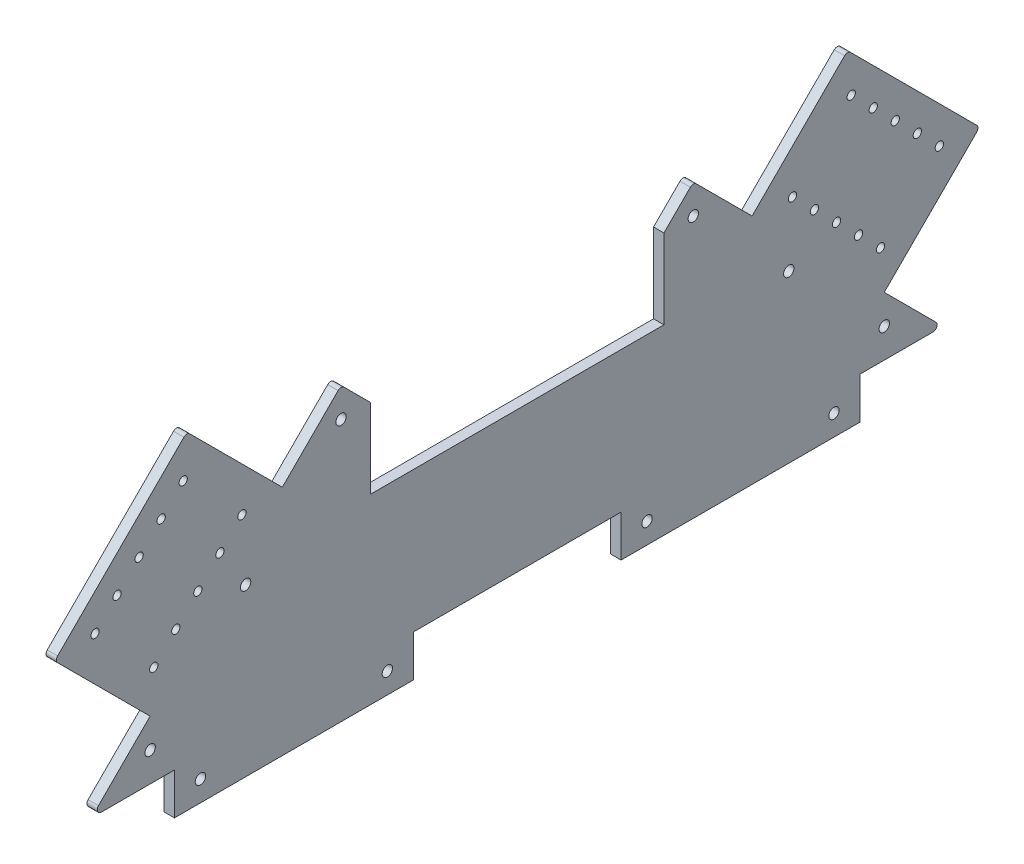
from build123d import *

# Parameters (mm, degrees)
SKETCH_1_R      = 2.5
SKETCH_1_R_2    = 2
EXTRUDE_1_DEPTH = 5
FILLET_1_R      = 2


with BuildPart() as part:
    # 草图1 → 凸台-拉伸1 (new body)
    with BuildSketch(Plane(origin=(0, 0, 0), x_dir=(0, 0, -1), z_dir=(1, 0, 0))):
        Polygon((165, 0), (205, 0), (176.715728753, 28.284271247), (222.67766953, 74.246212025), (159.038059223, 137.885822331), (113.076118446, 91.923881554), (84.791847198, 120.208152802), (70.649711575, 106.066017178), (70.649711575, 67.772939569), (-70.649711575, 67.772939569), (-70.649711575, 106.066017178), (-84.791847198, 120.208152802), (-113.076118446, 91.923881554), (-159.038059223, 137.885822331), (-222.67766953, 74.246212025), (-176.715728753, 28.284271247), (-205, 0), (-165, 0), (-165, -20), (-50, -20), (-50, 0), (50, 0), (50, -20), (165, -20), align=None)
        with Locations((-176.715728753, 14.142135624)):
            Circle(SKETCH_1_R, mode=Mode.SUBTRACT)
        with Locations((-174.9479618, 47.72970773)):
            Circle(SKETCH_1_R_2, mode=Mode.SUBTRACT)
        with Locations((-164.341360082, 58.336309448)):
            Circle(SKETCH_1_R_2, mode=Mode.SUBTRACT)
        with Locations((176.715728753, 14.142135624)):
            Circle(SKETCH_1_R, mode=Mode.SUBTRACT)
        with Locations((164.341360082, 58.336309448)):
            Circle(SKETCH_1_R_2, mode=Mode.SUBTRACT)
        with Locations((174.9479618, 47.72970773)):
            Circle(SKETCH_1_R_2, mode=Mode.SUBTRACT)
        with Locations((-203.232233047, 76.013978978)):
            Circle(SKETCH_1_R_2, mode=Mode.SUBTRACT)
        with Locations((-130.753787975, 60.104076401)):
            Circle(SKETCH_1_R, mode=Mode.SUBTRACT)
        with Locations((-153.734758364, 68.942911166)):
            Circle(SKETCH_1_R_2, mode=Mode.SUBTRACT)
        with Locations((-192.625631329, 86.620580695)):
            Circle(SKETCH_1_R_2, mode=Mode.SUBTRACT)
        with Locations((-182.019029611, 97.227182413)):
            Circle(SKETCH_1_R_2, mode=Mode.SUBTRACT)
        with Locations((-143.128156646, 79.549512883)):
            Circle(SKETCH_1_R_2, mode=Mode.SUBTRACT)
        with Locations((-132.521554928, 90.156114601)):
            Circle(SKETCH_1_R_2, mode=Mode.SUBTRACT)
        with Locations((-171.412427894, 107.833784131)):
            Circle(SKETCH_1_R_2, mode=Mode.SUBTRACT)
        with Locations((-160.805826176, 118.440385849)):
            Circle(SKETCH_1_R_2, mode=Mode.SUBTRACT)
        with Locations((-84.791847198, 106.066017178)):
            Circle(SKETCH_1_R, mode=Mode.SUBTRACT)
        with Locations((130.753787975, 60.104076401)):
            Circle(SKETCH_1_R, mode=Mode.SUBTRACT)
        with Locations((153.734758364, 68.942911166)):
            Circle(SKETCH_1_R_2, mode=Mode.SUBTRACT)
        with Locations((203.232233047, 76.013978978)):
            Circle(SKETCH_1_R_2, mode=Mode.SUBTRACT)
        with Locations((143.128156646, 79.549512883)):
            Circle(SKETCH_1_R_2, mode=Mode.SUBTRACT)
        with Locations((132.521554928, 90.156114601)):
            Circle(SKETCH_1_R_2, mode=Mode.SUBTRACT)
        with Locations((192.625631329, 86.620580695)):
            Circle(SKETCH_1_R_2, mode=Mode.SUBTRACT)
        with Locations((182.019029611, 97.227182413)):
            Circle(SKETCH_1_R_2, mode=Mode.SUBTRACT)
        with Locations((84.791847198, 106.066017178)):
            Circle(SKETCH_1_R, mode=Mode.SUBTRACT)
        with Locations((171.412427894, 107.833784131)):
            Circle(SKETCH_1_R_2, mode=Mode.SUBTRACT)
        with Locations((160.805826176, 118.440385849)):
            Circle(SKETCH_1_R_2, mode=Mode.SUBTRACT)
        with Locations((152.5, -10)):
            Circle(SKETCH_1_R, mode=Mode.SUBTRACT)
        with Locations((62.5, -10)):
            Circle(SKETCH_1_R, mode=Mode.SUBTRACT)
        with Locations((-62.5, -10)):
            Circle(SKETCH_1_R, mode=Mode.SUBTRACT)
        with Locations((-152.5, -10)):
            Circle(SKETCH_1_R, mode=Mode.SUBTRACT)
    extrude(amount=EXTRUDE_1_DEPTH)

    # 圆角1
    fillet_1_edges = [part.edges().sort_by_distance(p)[0] for p in [
        (2.5, 137.885822331, -159.038059223),
        (2.5, 74.246212025, -222.67766953),
        (2.5, 0, -205),
        (2.5, 0, 205),
        (2.5, 74.246212025, 222.67766953),
        (2.5, 137.885822331, 159.038059223),
        (2.5, 120.208152802, 84.791847198),
        (2.5, 120.208152802, -84.791847198),
    ]]
    fillet(fillet_1_edges, radius=FILLET_1_R)


solid = part.part
